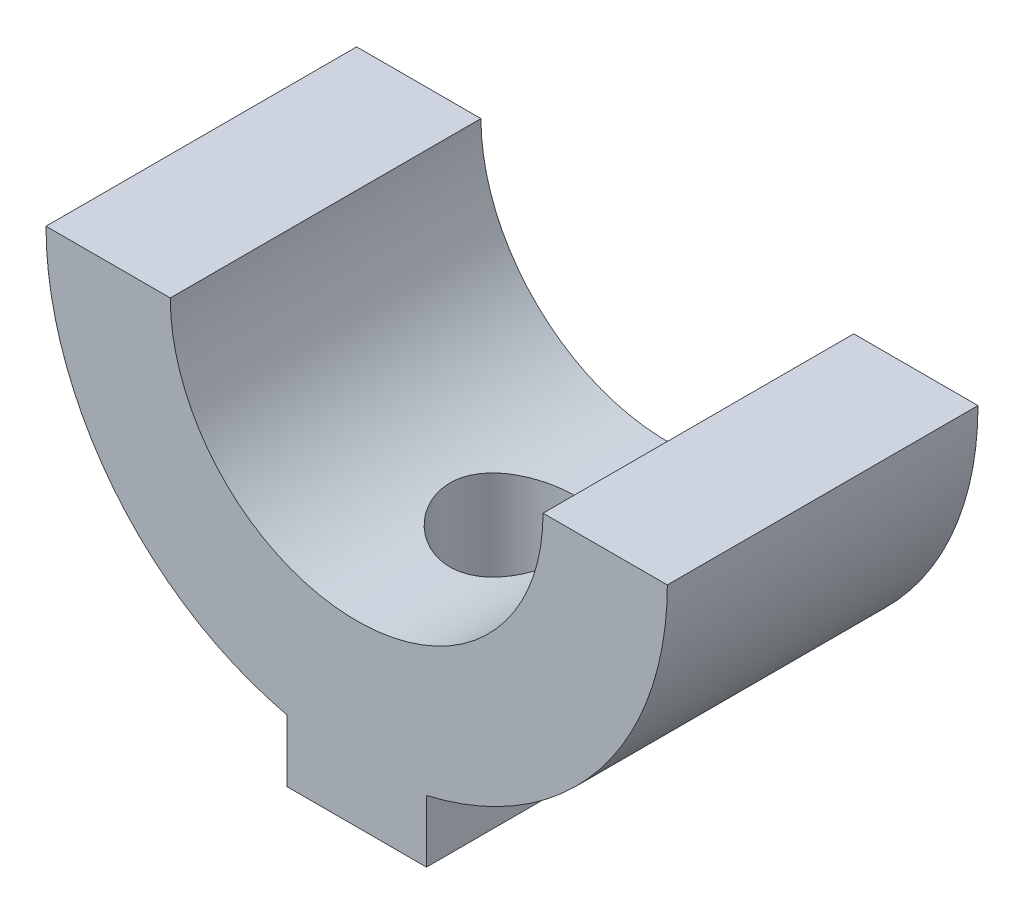
from build123d import *

# Parameters (mm, degrees)
BOSS_EXTRUDE1_DEPTH = 2.5
SKETCH3_R           = 1
CUT_EXTRUDE1_DEPTH  = 5


with BuildPart() as part:
    # Sketch1 → Boss-Extrude1 (new, symmetric)
    with BuildSketch(Plane.XY):
        with BuildLine():
            ThreePointArc((-230.921678322, 34.636363636), (-231.800357978, 32.515043293), (-233.921678322, 31.636363636))
            Line((-233.921678322, 31.636363636), (-233.921678322, 29.636363636))
            ThreePointArc((-233.921678322, 29.636363636), (-233.356489225, 29.668410206), (-232.798545076, 29.764139123))
            ThreePointArc((-232.798545076, 29.764139123), (-230.009155719, 31.52313912), (-228.921678322, 34.636363636))
            Line((-228.921678322, 34.636363636), (-230.921678322, 34.636363636))
        make_face()
        with BuildLine():
            ThreePointArc((-233.921678322, 31.636363636), (-236.042998665, 32.515043293), (-236.921678322, 34.636363636))
            Line((-236.921678322, 34.636363636), (-238.921678322, 34.636363636))
            ThreePointArc((-238.921678322, 34.636363636), (-237.834200924, 31.52313912), (-235.044811567, 29.764139123))
            ThreePointArc((-235.044811567, 29.764139123), (-234.486867419, 29.668410206), (-233.921678322, 29.636363636))
            Line((-233.921678322, 29.636363636), (-233.921678322, 31.636363636))
        make_face()
        with BuildLine():
            ThreePointArc((-232.798545076, 29.764139123), (-233.356489225, 29.668410206), (-233.921678322, 29.636363636))
            Line((-233.921678322, 29.636363636), (-233.921678322, 28.764139123))
            Line((-233.921678322, 28.764139123), (-232.798545076, 28.764139123))
            Line((-232.798545076, 28.764139123), (-232.798545076, 29.764139123))
        make_face()
        with BuildLine():
            ThreePointArc((-233.921678322, 29.636363636), (-234.486867419, 29.668410206), (-235.044811567, 29.764139123))
            Line((-235.044811567, 29.764139123), (-235.044811567, 28.764139123))
            Line((-235.044811567, 28.764139123), (-233.921678322, 28.764139123))
            Line((-233.921678322, 28.764139123), (-233.921678322, 29.636363636))
        make_face()
    extrude(amount=BOSS_EXTRUDE1_DEPTH, both=True)

    # Sketch3 → Cut-Extrude1 (cut)
    with BuildSketch(Plane.XZ.offset(-28.764139123)):
        with Locations(Location((-233.921678322, 0, 0), (0, 0, 270))):
            Circle(SKETCH3_R)
    extrude(amount=-CUT_EXTRUDE1_DEPTH, mode=Mode.SUBTRACT)


solid = part.part
